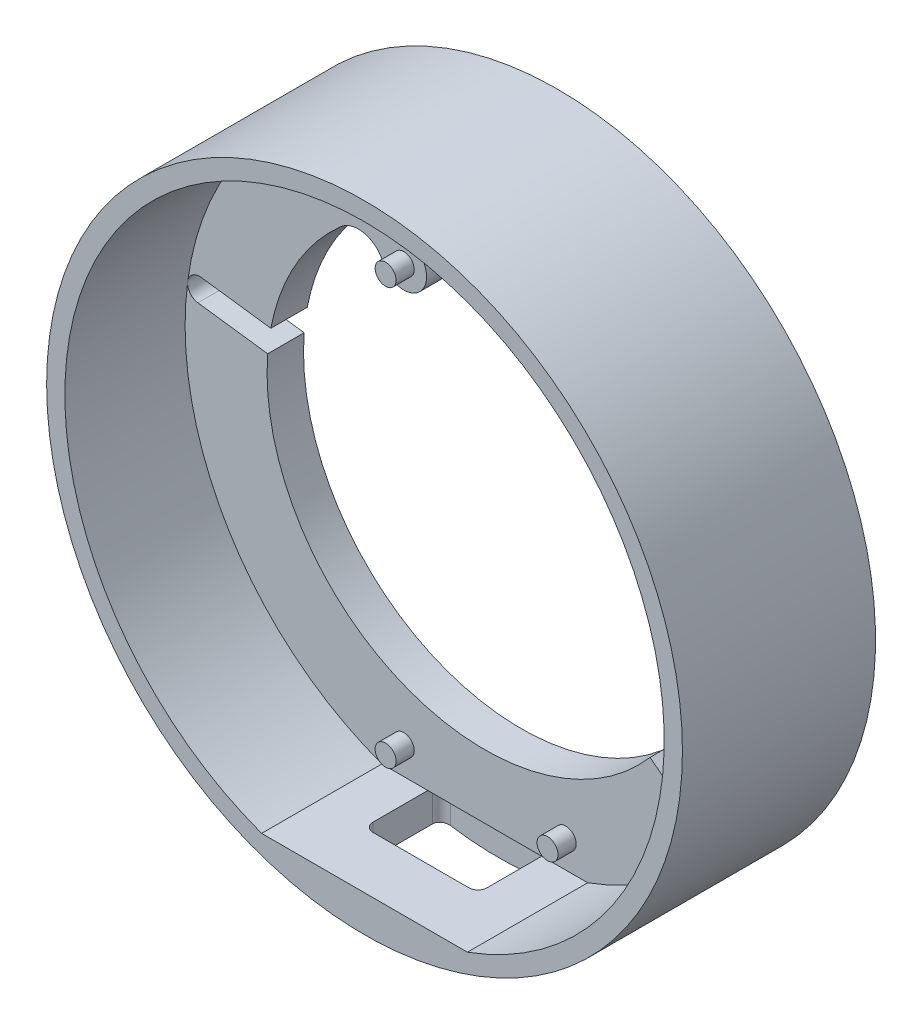
from build123d import *
from build123d.topology import SkipClean

# Parameters (mm, degrees)
ESQUISSE_SUPPORT_R      = 34.9
BOSS_EXTRU_1_DEPTH      = 4
ESQUISSE6_R             = 1.15
BOSS_EXTRU_2_DEPTH      = 2
BOSS_EXTRU_3_START      = 4
ESQUISSE7_R             = 34.9
ESQUISSE7_R_2           = 32.9
BOSS_EXTRU_3_DEPTH      = 4
ESQUISSE8_R             = 34.9
BOSS_EXTRU_5_DEPTH      = 13.2
ENL_V_MAT_EXTRU_1_DEPTH = 10


with BuildPart() as part:
    # Esquisse_support → Boss.-Extru.1 (new body)
    with BuildSketch(Plane.XY):
        Circle(ESQUISSE_SUPPORT_R)
        with BuildLine():
            ThreePointArc((-6.559988321, 18.766115653), (-6.450497051, 21.686422251), (-4.183806862, 23.530953235))
            ThreePointArc((-4.183806862, 23.530953235), (0, 23.9), (4.183806862, 23.530953235))
            ThreePointArc((4.183806862, 23.530953235), (6.450497051, 21.686422251), (6.559988321, 18.766115653))
            ThreePointArc((6.559988321, 18.766115653), (7.983884347, 15.529988321), (11.220011679, 16.953884347))
            Line((11.220011679, 16.953884347), (13.517895322, 19.709807357))
            Line((13.517895322, 19.709807357), (18.243699169, 25.871764581))
            ThreePointArc((18.243699169, 25.871764581), (19.084157828, 26.35728211), (20.021764581, 26.106300831))
            ThreePointArc((20.021764581, 26.106300831), (20.50728211, 25.265842172), (20.256300831, 24.328235419))
            Line((20.256300831, 24.328235419), (15.530496983, 18.166278195))
            ThreePointArc((15.530496983, 18.166278195), (23.692512492, 3.142427693), (19.729143793, -13.489658454))
            Line((19.729143793, -13.489658454), (25.863736665, -18.195211742))
            ThreePointArc((25.863736665, -18.195211742), (26.362962372, -19.059550784), (26.104788258, -20.023736665))
            ThreePointArc((26.104788258, -20.023736665), (25.240449216, -20.522962372), (24.276263335, -20.264788258))
            Line((24.276263335, -20.264788258), (18.141670463, -15.559234969))
            ThreePointArc((18.141670463, -15.559234969), (-9.148411266, -22.079777429), (-23.829761597, 1.830973023))
            Line((-23.829761597, 1.830973023), (-31.491348477, 2.843711519))
            ThreePointArc((-31.491348477, 2.843711519), (-32.357776046, 3.344547295), (-32.616288481, 4.311348477))
            ThreePointArc((-32.616288481, 4.311348477), (-32.115452705, 5.177776046), (-31.148651523, 5.436288481))
            Line((-31.148651523, 5.436288481), (-23.487064643, 4.423549986))
            ThreePointArc((-23.487064643, 4.423549986), (-20.799295594, 11.772820511), (-15.881763126, 17.86))
            ThreePointArc((-15.881763126, 17.86), (-13.316845537, 18.611032405), (-11.220011679, 16.953884347))
            ThreePointArc((-11.220011679, 16.953884347), (-7.983884347, 15.529988321), (-6.559988321, 18.766115653))
        make_face(mode=Mode.SUBTRACT)
    extrude(amount=BOSS_EXTRU_1_DEPTH)

    # Esquisse6 → Boss.-Extru.2 (add)
    with BuildSketch(Plane.XY.offset(4)):
        with Locations((-8.89, 17.86)):
            Circle(ESQUISSE6_R)
        with Locations((-8.89, -27.86)):
            Circle(ESQUISSE6_R)
        with Locations(Location((8.89, -27.86, 0), (0, 0, 180))):
            Circle(ESQUISSE6_R)
        with Locations(Location((8.89, 17.86, 0), (0, 0, 180))):
            Circle(ESQUISSE6_R)
    extrude(amount=BOSS_EXTRU_2_DEPTH)

    # Esquisse7 → Boss.-Extru.3 (add)
    with BuildSketch(Plane(origin=(0, 0, 0), x_dir=(-1, 0, 0), z_dir=(0, 0, -1)).offset(BOSS_EXTRU_3_START)):
        Circle(ESQUISSE7_R)
        with Locations(Location((0, 0, 0), (0, 0, 217.490091077))):
            Circle(ESQUISSE7_R_2, mode=Mode.SUBTRACT)
    extrude(amount=-BOSS_EXTRU_3_DEPTH)

    # Esquisse8 → Boss.-Extru.5 (add)
    with BuildSketch(Plane.XY.offset(4)):
        with Locations(Location((0, 0, 0), (0, 0, 180))):
            Circle(ESQUISSE8_R)
        with BuildLine():
            ThreePointArc((-11.296016997, -30.9), (0, 32.9), (11.296016997, -30.9))
            Line((11.296016997, -30.9), (-11.296016997, -30.9))
        make_face(mode=Mode.SUBTRACT)
    extrude(amount=BOSS_EXTRU_5_DEPTH)

    # Ouverture_USB → Enlèv. mat.-Extru.1 (cut)
    with SkipClean():  # the faces are left unmerged after this step: merging them gives an invalid solid
        with BuildSketch(Plane(origin=(0, -30.9, 0), x_dir=(1, 0, 0), z_dir=(0, 1, 0))):
            with BuildLine():
                Line((-5.25, -11), (5.25, -11))
                ThreePointArc((5.25, -11), (5.957106781, -10.707106781), (6.25, -10))
                Line((6.25, -10), (6.25, -3.5))
                ThreePointArc((6.25, -3.5), (5.957106781, -2.792893219), (5.25, -2.5))
                Line((5.25, -2.5), (-5.25, -2.5))
                ThreePointArc((-5.25, -2.5), (-5.957106781, -2.792893219), (-6.25, -3.5))
                Line((-6.25, -3.5), (-6.25, -10))
                ThreePointArc((-6.25, -10), (-5.957106781, -10.707106781), (-5.25, -11))
            make_face()
        extrude(amount=-ENL_V_MAT_EXTRU_1_DEPTH, mode=Mode.SUBTRACT)


solid = part.part
